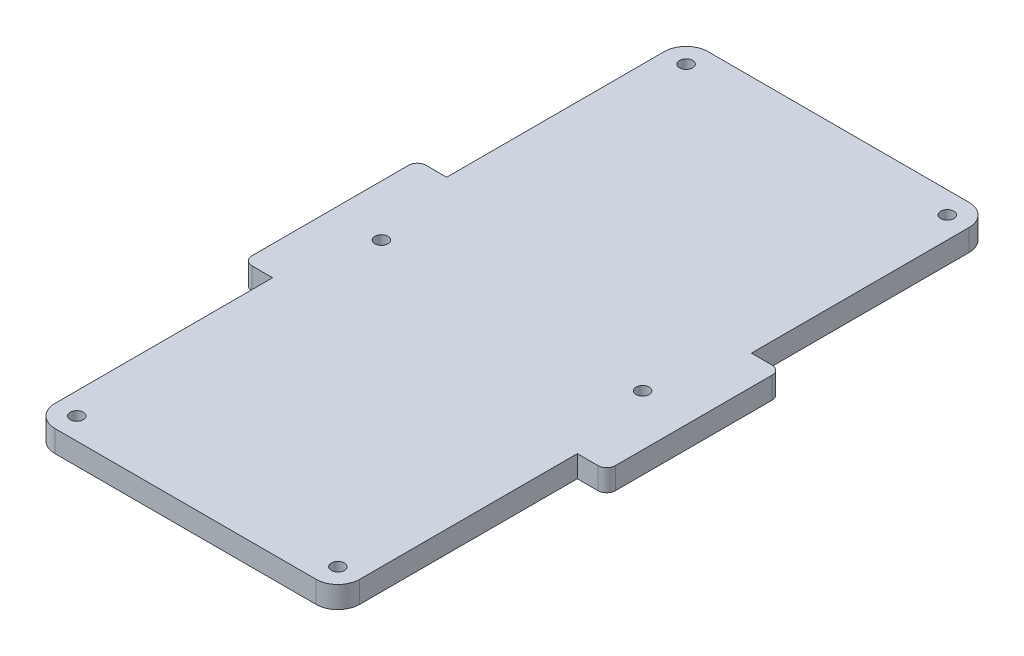
from build123d import *

# Parameters (mm, degrees)
EXTRUDE_1_DEPTH     = 5
SKETCH_3_R          = 1.5
CUT_EXTRUDE_1_DEPTH = 114.61053585


with BuildPart() as part:
    # 草图1 → 凸台-拉伸1 (new body)
    with BuildSketch(Plane(origin=(0, 0, 0), x_dir=(1, 0, 0), z_dir=(0, 1, 0))):
        with BuildLine():
            Line((-25.929831279, 46.15942029), (34.070168721, 46.15942029))
            ThreePointArc((34.070168721, 46.15942029), (37.605702627, 44.694954196), (39.070168721, 41.15942029))
            Line((39.070168721, 41.15942029), (39.070168721, -8.84057971))
            Line((39.070168721, -8.84057971), (43.820168721, -8.84057971))
            ThreePointArc((43.820168721, -8.84057971), (45.234382283, -9.426366148), (45.820168721, -10.84057971))
            Line((45.820168721, -10.84057971), (45.820168721, -46.84057971))
            ThreePointArc((45.820168721, -46.84057971), (45.234382283, -48.254793273), (43.820168721, -48.84057971))
            Line((43.820168721, -48.84057971), (39.070168721, -48.84057971))
            Line((39.070168721, -48.84057971), (39.070168721, -98.84057971))
            ThreePointArc((39.070168721, -98.84057971), (37.605702627, -102.376113616), (34.070168721, -103.84057971))
            Line((34.070168721, -103.84057971), (-25.929831279, -103.84057971))
            ThreePointArc((-25.929831279, -103.84057971), (-29.465365185, -102.376113616), (-30.929831279, -98.84057971))
            Line((-30.929831279, -98.84057971), (-30.929831279, -48.84057971))
            Line((-30.929831279, -48.84057971), (-35.679831279, -48.84057971))
            ThreePointArc((-35.679831279, -48.84057971), (-37.094044841, -48.254793273), (-37.679831279, -46.84057971))
            Line((-37.679831279, -46.84057971), (-37.679831279, -10.84057971))
            ThreePointArc((-37.679831279, -10.84057971), (-37.094044841, -9.426366148), (-35.679831279, -8.84057971))
            Line((-35.679831279, -8.84057971), (-30.929831279, -8.84057971))
            Line((-30.929831279, -8.84057971), (-30.929831279, 41.15942029))
            ThreePointArc((-30.929831279, 41.15942029), (-29.465365185, 44.694954196), (-25.929831279, 46.15942029))
        make_face()
    extrude(amount=EXTRUDE_1_DEPTH)

    # 草图3 → 切除-拉伸1 (cut, through all)
    with BuildSketch(Plane(origin=(0, 5, 0), x_dir=(1, 0, 0), z_dir=(0, 1, 0))):
        with Locations(Location((34.070168721, 41.15942029, 0), (0, 0, 270))):
            Circle(SKETCH_3_R)
        with Locations(Location((-25.929831279, 41.15942029, 0), (0, 0, 270))):
            Circle(SKETCH_3_R)
        with Locations(Location((-25.929831279, -98.84057971, 0), (0, 0, 270))):
            Circle(SKETCH_3_R)
        with Locations(Location((34.070168721, -98.84057971, 0), (0, 0, 270))):
            Circle(SKETCH_3_R)
        with Locations(Location((34.070168721, -28.84057971, 0), (0, 0, 270))):
            Circle(SKETCH_3_R)
        with Locations(Location((-25.929831279, -28.84057971, 0), (0, 0, 270))):
            Circle(SKETCH_3_R)
    extrude(amount=-CUT_EXTRUDE_1_DEPTH, mode=Mode.SUBTRACT)


solid = part.part
